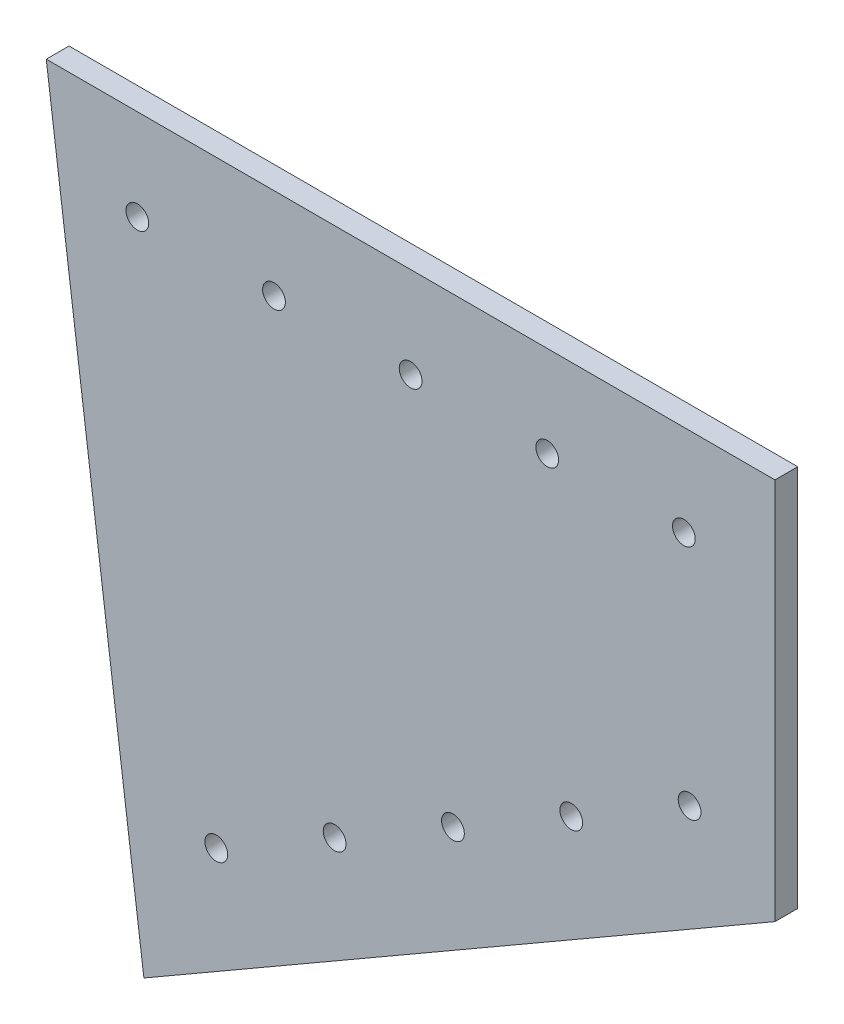
from build123d import *

# Parameters (mm, degrees)
BOSS_EXTRUDE1_DEPTH = 3.175
CUT_EXTRUDE1_REACH  = 116.795
SKETCH2_R           = 1.5875


with BuildPart() as part:
    # Sketch1 → Boss-Extrude1 (new body)
    with BuildSketch(Plane.XY):
        Polygon((0, 0), (0, 53.34), (-101.6, 53.34), (-87.988181024, -50.8), align=None)
    extrude(amount=BOSS_EXTRUDE1_DEPTH)

    # Sketch2 → Cut-Extrude1 (cut, up to next)
    with BuildSketch(Plane(origin=(0, 0, 0), x_dir=(-1, 0, 0), z_dir=(0, 0, -1)), mode=Mode.PRIVATE) as cut_extrude1_sk1:
        with Locations((12.7, 40.64)):
            Circle(SKETCH2_R)
    cut_extrude1_tool1 = extrude(cut_extrude1_sk1.sketch, amount=-CUT_EXTRUDE1_REACH, mode=Mode.PRIVATE) & part.part
    # Sketch2 → Cut-Extrude1 (cut, up to next)
    with BuildSketch(Plane(origin=(0, 0, 0), x_dir=(-1, 0, 0), z_dir=(0, 0, -1)), mode=Mode.PRIVATE) as cut_extrude1_sk2:
        with Locations((31.75, 40.64)):
            Circle(SKETCH2_R)
    cut_extrude1_tool2 = extrude(cut_extrude1_sk2.sketch, amount=-CUT_EXTRUDE1_REACH, mode=Mode.PRIVATE) & part.part
    # Sketch2 → Cut-Extrude1 (cut, up to next)
    with BuildSketch(Plane(origin=(0, 0, 0), x_dir=(-1, 0, 0), z_dir=(0, 0, -1)), mode=Mode.PRIVATE) as cut_extrude1_sk3:
        with Locations((50.8, 40.64)):
            Circle(SKETCH2_R)
    cut_extrude1_tool3 = extrude(cut_extrude1_sk3.sketch, amount=-CUT_EXTRUDE1_REACH, mode=Mode.PRIVATE) & part.part
    # Sketch2 → Cut-Extrude1 (cut, up to next)
    with BuildSketch(Plane(origin=(0, 0, 0), x_dir=(-1, 0, 0), z_dir=(0, 0, -1)), mode=Mode.PRIVATE) as cut_extrude1_sk4:
        with Locations((69.85, 40.64)):
            Circle(SKETCH2_R)
    cut_extrude1_tool4 = extrude(cut_extrude1_sk4.sketch, amount=-CUT_EXTRUDE1_REACH, mode=Mode.PRIVATE) & part.part
    # Sketch2 → Cut-Extrude1 (cut, up to next)
    with BuildSketch(Plane(origin=(0, 0, 0), x_dir=(-1, 0, 0), z_dir=(0, 0, -1)), mode=Mode.PRIVATE) as cut_extrude1_sk5:
        with Locations((88.9, 40.64)):
            Circle(SKETCH2_R)
    cut_extrude1_tool5 = extrude(cut_extrude1_sk5.sketch, amount=-CUT_EXTRUDE1_REACH, mode=Mode.PRIVATE) & part.part
    # Sketch2 → Cut-Extrude1 (cut, up to next)
    with BuildSketch(Plane(origin=(0, 0, 0), x_dir=(-1, 0, 0), z_dir=(0, 0, -1)), mode=Mode.PRIVATE) as cut_extrude1_sk6:
        with Locations((11.903880744, 8.025962948)):
            Circle(SKETCH2_R)
    cut_extrude1_tool6 = extrude(cut_extrude1_sk6.sketch, amount=-CUT_EXTRUDE1_REACH, mode=Mode.PRIVATE) & part.part
    # Sketch2 → Cut-Extrude1 (cut, up to next)
    with BuildSketch(Plane(origin=(0, 0, 0), x_dir=(-1, 0, 0), z_dir=(0, 0, -1)), mode=Mode.PRIVATE) as cut_extrude1_sk7:
        with Locations((28.401664686, -1.499037052)):
            Circle(SKETCH2_R)
    cut_extrude1_tool7 = extrude(cut_extrude1_sk7.sketch, amount=-CUT_EXTRUDE1_REACH, mode=Mode.PRIVATE) & part.part
    # Sketch2 → Cut-Extrude1 (cut, up to next)
    with BuildSketch(Plane(origin=(0, 0, 0), x_dir=(-1, 0, 0), z_dir=(0, 0, -1)), mode=Mode.PRIVATE) as cut_extrude1_sk8:
        with Locations((44.899448628, -11.024037052)):
            Circle(SKETCH2_R)
    cut_extrude1_tool8 = extrude(cut_extrude1_sk8.sketch, amount=-CUT_EXTRUDE1_REACH, mode=Mode.PRIVATE) & part.part
    # Sketch2 → Cut-Extrude1 (cut, up to next)
    with BuildSketch(Plane(origin=(0, 0, 0), x_dir=(-1, 0, 0), z_dir=(0, 0, -1)), mode=Mode.PRIVATE) as cut_extrude1_sk9:
        with Locations((61.39723257, -20.549037052)):
            Circle(SKETCH2_R)
    cut_extrude1_tool9 = extrude(cut_extrude1_sk9.sketch, amount=-CUT_EXTRUDE1_REACH, mode=Mode.PRIVATE) & part.part
    # Sketch2 → Cut-Extrude1 (cut, up to next)
    with BuildSketch(Plane(origin=(0, 0, 0), x_dir=(-1, 0, 0), z_dir=(0, 0, -1)), mode=Mode.PRIVATE) as cut_extrude1_sk10:
        with Locations((77.895016512, -30.074037052)):
            Circle(SKETCH2_R)
    cut_extrude1_tool10 = extrude(cut_extrude1_sk10.sketch, amount=-CUT_EXTRUDE1_REACH, mode=Mode.PRIVATE) & part.part
    add(cut_extrude1_tool1.solids().sort_by_distance((-12.7, 40.64, 0))[0], mode=Mode.SUBTRACT)
    add(cut_extrude1_tool2.solids().sort_by_distance((-31.75, 40.64, 0))[0], mode=Mode.SUBTRACT)
    add(cut_extrude1_tool3.solids().sort_by_distance((-50.8, 40.64, 0))[0], mode=Mode.SUBTRACT)
    add(cut_extrude1_tool4.solids().sort_by_distance((-69.85, 40.64, 0))[0], mode=Mode.SUBTRACT)
    add(cut_extrude1_tool5.solids().sort_by_distance((-88.9, 40.64, 0))[0], mode=Mode.SUBTRACT)
    add(cut_extrude1_tool6.solids().sort_by_distance((-11.903881, 8.025963, 0))[0], mode=Mode.SUBTRACT)
    add(cut_extrude1_tool7.solids().sort_by_distance((-28.401665, -1.499037, 0))[0], mode=Mode.SUBTRACT)
    add(cut_extrude1_tool8.solids().sort_by_distance((-44.899449, -11.024037, 0))[0], mode=Mode.SUBTRACT)
    add(cut_extrude1_tool9.solids().sort_by_distance((-61.397233, -20.549037, 0))[0], mode=Mode.SUBTRACT)
    add(cut_extrude1_tool10.solids().sort_by_distance((-77.895017, -30.074037, 0))[0], mode=Mode.SUBTRACT)


solid = part.part
